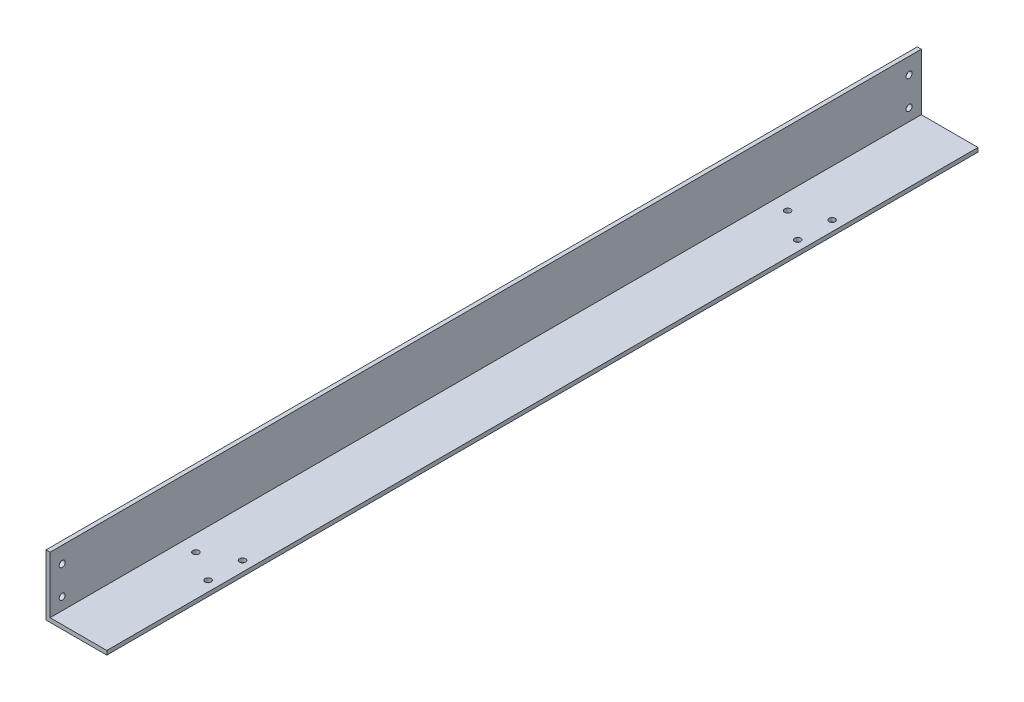
from build123d import *

# Parameters (mm, degrees)
BOSS_EXTRUDE1_DEPTH      = 410
BOSS_EXTRUDE1_DEPTH_BACK = 20
F_3_0_3_DIAMETER_HOLE1_D = 3
F_3_0_3_DIAMETER_HOLE2_D = 3
F_3_0_3_DIAMETER_HOLE3_D = 3
F_3_0_3_DIAMETER_HOLE4_D = 3


with BuildPart() as part:
    # Sketch1 → Boss-Extrude1 (new, two sides: drawn at the far end of the back side and taken through both)
    with BuildSketch(Plane.XY.offset(-BOSS_EXTRUDE1_DEPTH_BACK)):
        Polygon((0, 5.602318429), (0, 35.602318429), (2, 35.602318429), (2, 7.602318429), (30, 7.602318429), (30, 5.602318429), align=None)
    extrude(amount=BOSS_EXTRUDE1_DEPTH + BOSS_EXTRUDE1_DEPTH_BACK)

    # Ø3.0 (3) Diameter Hole1 (through all)
    with Locations(Plane(origin=(2, -3.805314364, 221.32004832), x_dir=(0, 0, -1), z_dir=(1, 0, 0))):
        with Locations((-182.67995168, 17.407632793), (-182.67995168, 31.407632793)):
            Hole(F_3_0_3_DIAMETER_HOLE1_D / 2)

    # Ø3.0 (3) Diameter Hole2 (through all)
    with Locations(Plane(origin=(2, -3.805314364, 221.32004832), x_dir=(0, 0, -1), z_dir=(1, 0, 0))):
        with Locations((235.32004832, 17.407632793), (235.32004832, 31.407632793)):
            Hole(F_3_0_3_DIAMETER_HOLE2_D / 2)

    # Ø3.0 (3) Diameter Hole3 (through all)
    with Locations(Plane(origin=(130.861996081, 5.602318429, 221.32004832), x_dir=(-1, 0, 0), z_dir=(0, -1, 0))):
        with Locations((105.861996081, -133.67995168), (120.861996081, -124.67995168), (105.861996081, -116.67995168)):
            Hole(F_3_0_3_DIAMETER_HOLE3_D / 2)

    # Ø3.0 (3) Diameter Hole4 (through all)
    with Locations(Plane(origin=(130.861996081, 5.602318429, 221.32004832), x_dir=(-1, 0, 0), z_dir=(0, -1, 0))):
        with Locations((105.861996081, 174.32004832), (105.861996081, 157.32004832), (120.861996081, 167.32004832)):
            Hole(F_3_0_3_DIAMETER_HOLE4_D / 2)


solid = part.part
